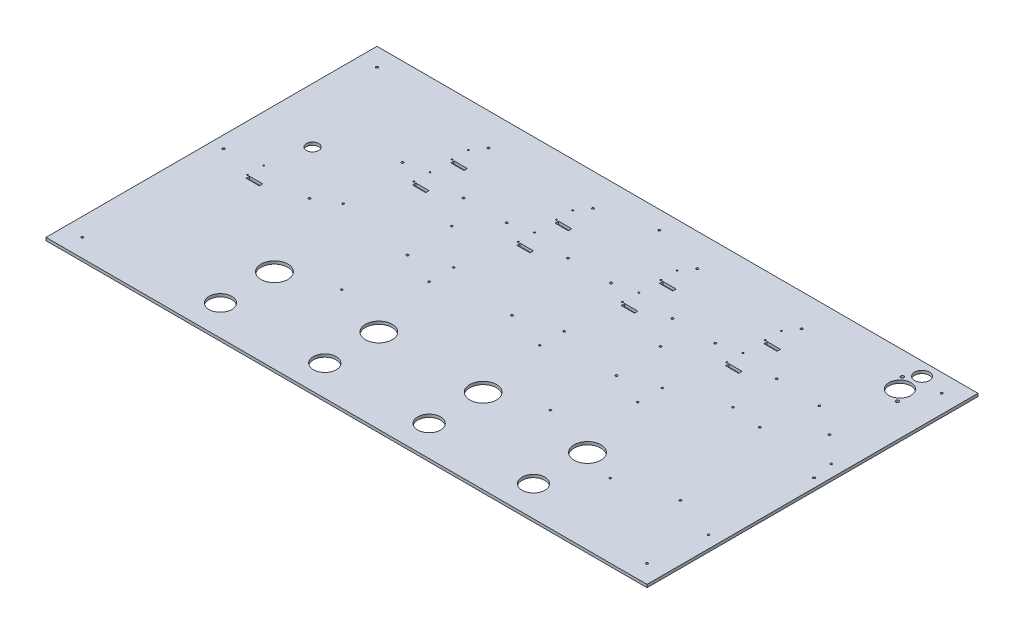
from build123d import *

# Parameters (mm, degrees)
SKETCH1_W                     = 660.4
SKETCH1_H                     = 381
SHEET_DEPTH                   = 2.9972
SKETCH2_7_W                   = 13.716
SKETCH2_7_H                   = 3.556
SKETCH2_7_R                   = 11.811
SKETCH2_7_R_2                 = 13.843
SKETCH2_7_R_3                 = 0.762
CHANNEL_CONTROLS_BOTTOM_DEPTH = 382.223390164
LPATTERN1_COUNT               = 4
LPATTERN1_PITCH               = 107.95
SKETCH5_5_W                   = 13.716
SKETCH5_5_H                   = 3.556
SKETCH5_5_R                   = 0.762
CUT_EXTRUDE2_DEPTH            = 382.223390164
SKETCH6_R                     = 7.62
SKETCH6_R_2                   = 11.43
SKETCH6_R_3                   = 1.651
MIC_ROUTING_BOTTOM_DEPTH      = 382.223390164
SKETCH16_R                    = 6.35
WIRING_PATH_INPUT_DEPTH       = 382.223390164
SKETCH18_R                    = 1.143
INSIDE_SCREW_HOLES_DEPTH      = 382.223390164
SKETCH17_W                    = 660.4
SKETCH17_H                    = 381
SKETCH17_W_2                  = 621.792
SKETCH17_H_2                  = 342.392
CUT_IN_EDGES_DEPTH            = 382.223390164
SKETCH19_R                    = 1.016
PCB_MOUNT_DEPTH               = 2.54
SKETCH20_R                    = 1.016
CABLE_MANAGEMENT_DEPTH        = 2.54


with BuildPart() as part:
    # Sketch1 → Sheet (new body)
    with BuildSketch(Plane(origin=(0, 0, 0), x_dir=(1, 0, 0), z_dir=(0, 1, 0))):
        Rectangle(SKETCH1_W, SKETCH1_H)
    extrude(amount=SHEET_DEPTH)

    # Sketch2<7> → Channel Controls - Bottom (cut, through all)
    with BuildSketch(Plane(origin=(0, 2.9972, 0), x_dir=(1, 0, 0), z_dir=(0, 1, 0))):
        with Locations((-161.417, 106.68)):
            Rectangle(SKETCH2_7_W, SKETCH2_7_H)
        with Locations((-161.417, 67.056)):
            Rectangle(SKETCH2_7_W, SKETCH2_7_H)
        with Locations((-161.925, -139.7)):
            Circle(SKETCH2_7_R)
        with Locations((-161.925, -83.82)):
            Circle(SKETCH2_7_R_2)
        with Locations((-170.561, 125.476)):
            Circle(SKETCH2_7_R_3)
        with Locations((-170.561, 108.712)):
            Circle(SKETCH2_7_R_3)
        with Locations((-170.561, 85.852)):
            Circle(SKETCH2_7_R_3)
        with Locations((-170.561, 69.088)):
            Circle(SKETCH2_7_R_3)
    channel_controls_bottom = extrude(amount=-CHANNEL_CONTROLS_BOTTOM_DEPTH, mode=Mode.SUBTRACT)

    # LPattern1: Channel Controls - Bottom ×4
    with Locations(*[(i * LPATTERN1_PITCH, 0, 0) for i in range(1, LPATTERN1_COUNT)]):
        add(channel_controls_bottom, mode=Mode.SUBTRACT)

    # Sketch5<5> → Cut-Extrude2 (cut, through all)
    with BuildSketch(Plane(origin=(0, 2.9972, 0), x_dir=(1, 0, 0), z_dir=(0, 1, 0))):
        with Locations((-253.492, -12.954)):
            Rectangle(SKETCH5_5_W, SKETCH5_5_H)
        with Locations((-262.636, 5.842)):
            Circle(SKETCH5_5_R)
        with Locations((-262.636, -10.922)):
            Circle(SKETCH5_5_R)
    extrude(amount=-CUT_EXTRUDE2_DEPTH, mode=Mode.SUBTRACT)

    # Sketch6 → Mic - Routing/Bottom (cut, through all)
    with BuildSketch(Plane(origin=(0, 2.9972, 0), x_dir=(1, 0, 0), z_dir=(0, 1, 0))):
        with Locations((266.7, 157.48)):
            Circle(SKETCH6_R)
        with Locations((266.7, 134.62)):
            Circle(SKETCH6_R_2)
        with Locations((257.048, 146.812)):
            Circle(SKETCH6_R_3)
        with Locations((276.352, 122.428)):
            Circle(SKETCH6_R_3)
    extrude(amount=-MIC_ROUTING_BOTTOM_DEPTH, mode=Mode.SUBTRACT)

    # Sketch16 → Wiring Path Input (cut, through all)
    with BuildSketch(Plane(origin=(0, 2.9972, 0), x_dir=(1, 0, 0), z_dir=(0, 1, 0))):
        with Locations((-254, 47.675648725)):
            Circle(SKETCH16_R)
    extrude(amount=-WIRING_PATH_INPUT_DEPTH, mode=Mode.SUBTRACT)

    # Sketch18 → Inside Screw Holes (cut, through all)
    with BuildSketch(Plane(origin=(0, 2.9972, 0), x_dir=(1, 0, 0), z_dir=(0, 1, 0))):
        with Locations((-193.675, 80.158564581)):
            Circle(SKETCH18_R)
        with Locations((-161.925, 137.7044104)):
            Circle(SKETCH18_R)
        with Locations((-298.45, 0)):
            Circle(SKETCH18_R)
        with Locations((-209.55, 0)):
            Circle(SKETCH18_R)
        with Locations((-107.95, 0)):
            Circle(SKETCH18_R)
        with Locations((-292.1, 152.4)):
            Circle(SKETCH18_R)
        with Locations((0, 152.4)):
            Circle(SKETCH18_R)
        with Locations((-130.175, 80.158564581)):
            Circle(SKETCH18_R)
        with Locations((301.701065048, 10.72901122)):
            Circle(SKETCH18_R)
        with Locations((228.429380072, 27.954149694)):
            Circle(SKETCH18_R)
        with Locations((271.116831878, 57.283623384)):
            Circle(SKETCH18_R)
        with Locations((292.1, 152.4)):
            Circle(SKETCH18_R)
        Circle(SKETCH18_R)
        with Locations((107.95, 0)):
            Circle(SKETCH18_R)
        with Locations((252.912933296, -78.628784773)):
            Circle(SKETCH18_R)
        with Locations((292.1, -152.4)):
            Circle(SKETCH18_R)
        with Locations((-292.1, -152.4)):
            Circle(SKETCH18_R)
        with Locations((-53.975, 137.7044104)):
            Circle(SKETCH18_R)
        with Locations((-85.725, 80.158564581)):
            Circle(SKETCH18_R)
        with Locations((-22.225, 80.158564581)):
            Circle(SKETCH18_R)
        with Locations((53.975, 137.7044104)):
            Circle(SKETCH18_R)
        with Locations((22.225, 80.158564581)):
            Circle(SKETCH18_R)
        with Locations((85.725, 80.158564581)):
            Circle(SKETCH18_R)
        with Locations((161.925, 137.7044104)):
            Circle(SKETCH18_R)
        with Locations((130.175, 80.158564581)):
            Circle(SKETCH18_R)
        with Locations((193.675, 80.158564581)):
            Circle(SKETCH18_R)
    extrude(amount=-INSIDE_SCREW_HOLES_DEPTH, mode=Mode.SUBTRACT)

    # Sketch17 → Cut In Edges (cut, through all)
    with BuildSketch(Plane(origin=(0, 2.9972, 0), x_dir=(1, 0, 0), z_dir=(0, 1, 0))):
        Rectangle(SKETCH17_W, SKETCH17_H)
        Rectangle(SKETCH17_W_2, SKETCH17_H_2, mode=Mode.SUBTRACT)
    extrude(amount=-CUT_IN_EDGES_DEPTH, mode=Mode.SUBTRACT)

    # Sketch19 → PCB Mount (cut)
    with BuildSketch(Plane(origin=(0, 2.9972, 0), x_dir=(1, 0, 0), z_dir=(0, 1, 0))):
        with Locations((196.596, -94.996)):
            Circle(SKETCH19_R)
        with Locations((298.196, -94.996)):
            Circle(SKETCH19_R)
        with Locations((196.596, 32.004)):
            Circle(SKETCH19_R)
        with Locations((298.196, 32.004)):
            Circle(SKETCH19_R)
    extrude(amount=-PCB_MOUNT_DEPTH, mode=Mode.SUBTRACT)

    # Sketch20 → Cable Management (cut)
    with BuildSketch(Plane(origin=(0, 2.9972, 0), x_dir=(1, 0, 0), z_dir=(0, 1, 0))):
        with Locations((-111.125, 48.879696065)):
            Circle(SKETCH20_R)
        with Locations((104.775, 48.879696065)):
            Circle(SKETCH20_R)
        with Locations((104.775, -65.017488446)):
            Circle(SKETCH20_R)
        with Locations((-111.125, -65.017488446)):
            Circle(SKETCH20_R)
        with Locations((-73.025, 12.7)):
            Circle(SKETCH20_R)
        with Locations((-187.325, 12.7)):
            Circle(SKETCH20_R)
        with Locations((142.875, 12.7)):
            Circle(SKETCH20_R)
        with Locations((240.018187339, 77.871508946)):
            Circle(SKETCH20_R)
        with Locations((41.275, 12.7)):
            Circle(SKETCH20_R)
        with Locations((142.875, -12.7)):
            Circle(SKETCH20_R)
        with Locations((41.275, -12.7)):
            Circle(SKETCH20_R)
        with Locations((-73.025, -12.7)):
            Circle(SKETCH20_R)
    extrude(amount=-CABLE_MANAGEMENT_DEPTH, mode=Mode.SUBTRACT)


solid = part.part
